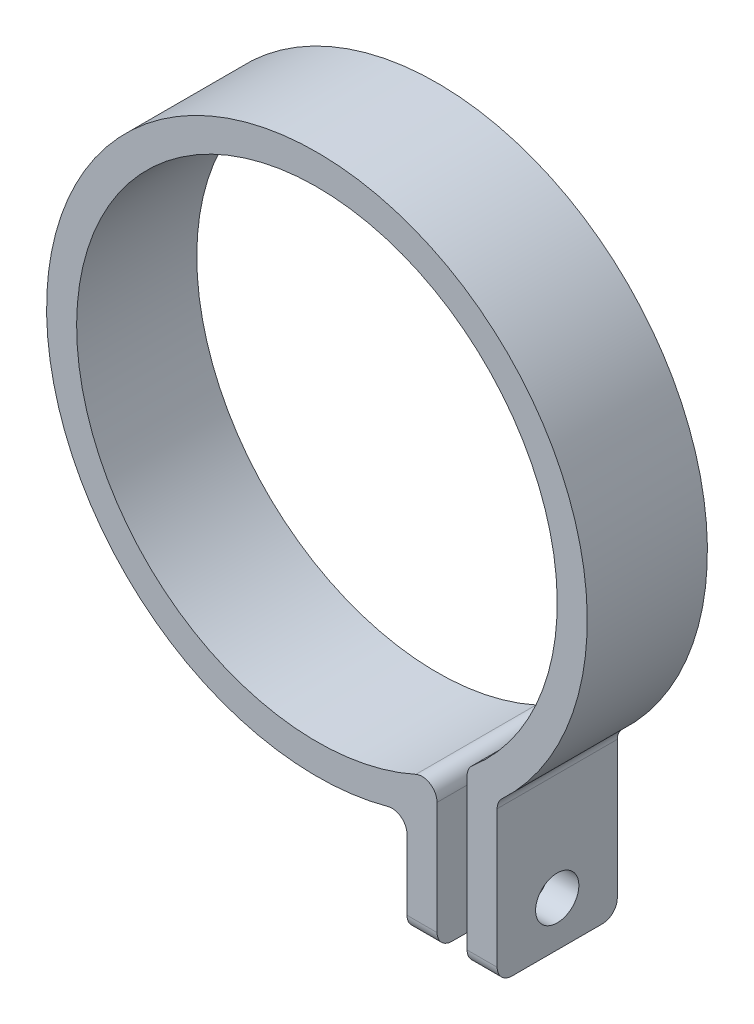
from build123d import *

# Parameters (mm, degrees)
BOSS_EXTRUDE1_DEPTH = 6.35
SKETCH2_R           = 2.286
CUT_EXTRUDE1_DEPTH  = 55.254423783
FILLET1_R           = 1.5875


with BuildPart() as part:
    # Sketch1 → Boss-Extrude1 (new, symmetric)
    with BuildSketch(Plane.XY):
        with BuildLine():
            Line((12.7, -21.997045256), (12.7, -38.1))
            Line((12.7, -38.1), (9.525, -38.1))
            Line((9.525, -38.1), (9.525, -26.940768363))
            ThreePointArc((9.525, -26.940768363), (-14.563355395, 24.585347357), (19.05, -21.298547486))
            Line((19.05, -21.298547486), (19.05, -38.1))
            Line((19.05, -38.1), (15.875, -38.1))
            Line((15.875, -38.1), (15.875, -19.827868645))
            ThreePointArc((15.875, -19.827868645), (-14.328607331, 20.9726253), (12.7, -21.997045256))
        make_face()
    extrude(amount=BOSS_EXTRUDE1_DEPTH, both=True)

    # Sketch2 → Cut-Extrude1 (cut, through all)
    with BuildSketch(Plane.ZY.offset(-9.525)):
        with Locations(Location((0, -33.3375, 0), (0, 0, 270))):
            Circle(SKETCH2_R)
    extrude(amount=-CUT_EXTRUDE1_DEPTH, mode=Mode.SUBTRACT)

    # Fillet1
    fillet1_edges = [part.edges().sort_by_distance(p)[0] for p in [
        (17.4625, -38.1, -6.35),
        (17.4625, -38.1, 6.35),
        (12.7, -21.997045256, 0),
        (9.525, -26.940768363, 0),
        (19.05, -21.298547486, 0),
        (15.875, -19.827868645, 0),
        (11.1125, -38.1, 6.35),
        (11.1125, -38.1, -6.35),
    ]]
    fillet(fillet1_edges, radius=FILLET1_R)


solid = part.part
